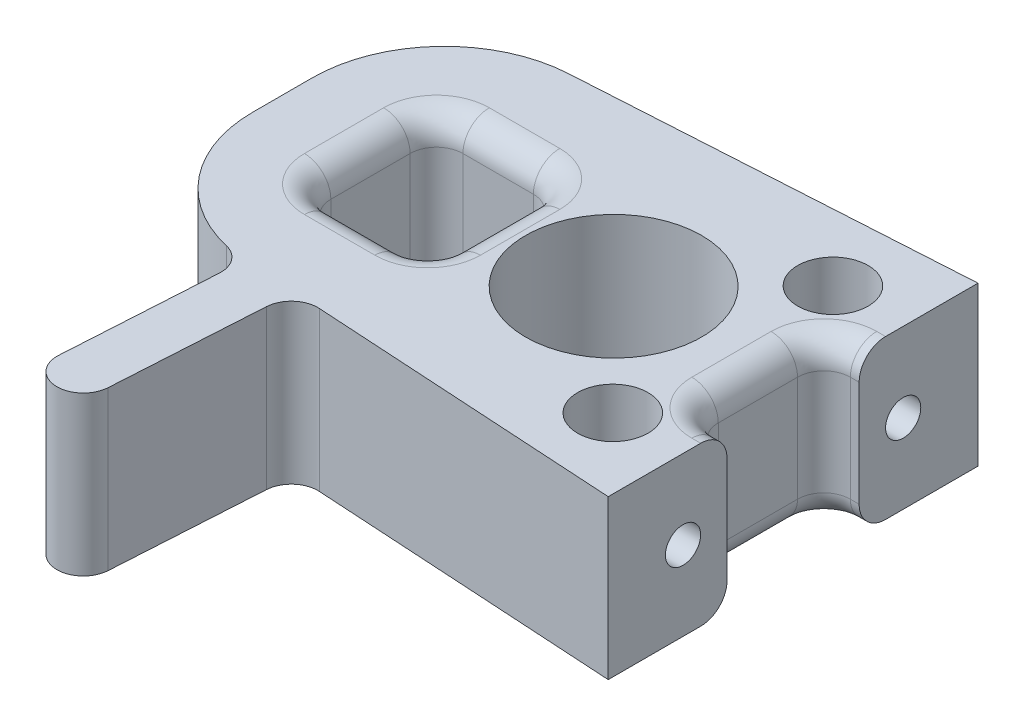
from build123d import *

# Parameters (mm, degrees)
SKETCH1_W           = 14
SKETCH1_H           = 15
BOSS_EXTRUDE1_DEPTH = 18
FILLET1_R           = 15
FILLET2_R           = 3
SKETCH2_R           = 2
CUT_EXTRUDE1_DEPTH  = 50
SKETCH3_R           = 4
SKETCH3_R_2         = 10
CUT_EXTRUDE2_DEPTH  = 15
SKETCH4_R           = 10
CUT_EXTRUDE3_DEPTH  = 17
BOSS_EXTRUDE2_DEPTH = 18
FILLET3_R           = 3


with BuildPart() as part:
    # Sketch1 → Boss-Extrude1 (new body)
    with BuildSketch(Plane(origin=(0, 0, 0), x_dir=(1, 0, 0), z_dir=(0, 1, 0))):
        Polygon((-17, 17.5), (41, 21), (41, 7.5), (37, 7.5), (37, -7.5), (41, -7.5), (41, -21), (-17, -17.5), align=None)
        Rectangle(SKETCH1_W, SKETCH1_H, mode=Mode.SUBTRACT)
    extrude(amount=BOSS_EXTRUDE1_DEPTH)

    # Fillet1
    fillet1_edges = [part.edges().sort_by_distance(p)[0] for p in [
        (-17, 9, -17.5),
        (-17, 9, 17.5),
    ]]
    fillet(fillet1_edges, radius=FILLET1_R)

    # Fillet2
    fillet2_edges = [part.edges().sort_by_distance(p)[0] for p in [
        (39, 18, 7.5),
        (37, 9, -7.5),
        (37, 9, 7.5),
        (37, 18, 0),
        (39, 18, -7.5),
        (0, 0, 7.5),
        (-7, 9, 7.5),
        (7, 0, 0),
        (7, 9, 7.5),
        (0, 0, -7.5),
        (7, 9, -7.5),
        (-7, 0, 0),
        (-7, 9, -7.5),
        (0, 18, 7.5),
        (7, 18, 0),
        (0, 18, -7.5),
        (-7, 18, 0),
        (39, 0, -7.5),
        (37, 0, 0),
        (39, 0, 7.5),
    ]]
    fillet(fillet2_edges, radius=FILLET2_R)

    # Sketch2 → Cut-Extrude1 (cut)
    with BuildSketch(Plane(origin=(41, 0, 0), x_dir=(0, 0, -1), z_dir=(1, 0, 0))):
        with Locations((-12.5, 9)):
            Circle(SKETCH2_R)
        with Locations((12.5, 9)):
            Circle(SKETCH2_R)
    extrude(amount=-CUT_EXTRUDE1_DEPTH, mode=Mode.SUBTRACT)

    # Sketch3 → Cut-Extrude2 (cut)
    with BuildSketch(Plane(origin=(0, 18, 0), x_dir=(1, 0, 0), z_dir=(0, 1, 0))):
        with Locations(Location((33.024254141, -12.5, 0), (0, 0, 270))):
            Circle(SKETCH3_R)
        with Locations(Location((33.024254141, 12.5, 0), (0, 0, 270))):
            Circle(SKETCH3_R)
        with Locations(Location((20.614190044, 0, 0), (0, 0, 270))):
            Circle(SKETCH3_R_2)
    extrude(amount=-CUT_EXTRUDE2_DEPTH, mode=Mode.SUBTRACT)

    # Sketch4 → Cut-Extrude3 (cut)
    with BuildSketch(Plane(origin=(0, 3, 0), x_dir=(1, 0, 0), z_dir=(0, 1, 0))):
        with Locations(Location((20.614190044, 0, 0), (0, 0, 270))):
            Circle(SKETCH4_R)
    extrude(amount=-CUT_EXTRUDE3_DEPTH, mode=Mode.SUBTRACT)

    # Sketch5 → Boss-Extrude2 (add)
    with BuildSketch(Plane(origin=(0, 18, 0), x_dir=(1, 0, 0), z_dir=(0, 1, 0))):
        with BuildLine():
            Line((-4.108233889, -38.314333294), (-2.903528809, -18.350649124))
            ThreePointArc((-2.903528809, -18.350649124), (0.271729578, -15.53680226), (3.085576442, -18.712060647))
            Line((3.085576442, -18.712060647), (1.880871363, -38.675744818))
            ThreePointArc((1.880871363, -38.675744818), (-1.294387025, -41.489591682), (-4.108233889, -38.314333294))
        make_face()
    extrude(amount=-BOSS_EXTRUDE2_DEPTH)

    # Fillet3
    fillet3_edges = [part.edges().sort_by_distance(p)[0] for p in [
        (3.085576442, 9, 18.712060647),
        (-2.903528809, 9, 18.350649124),
    ]]
    fillet(fillet3_edges, radius=FILLET3_R)


solid = part.part
